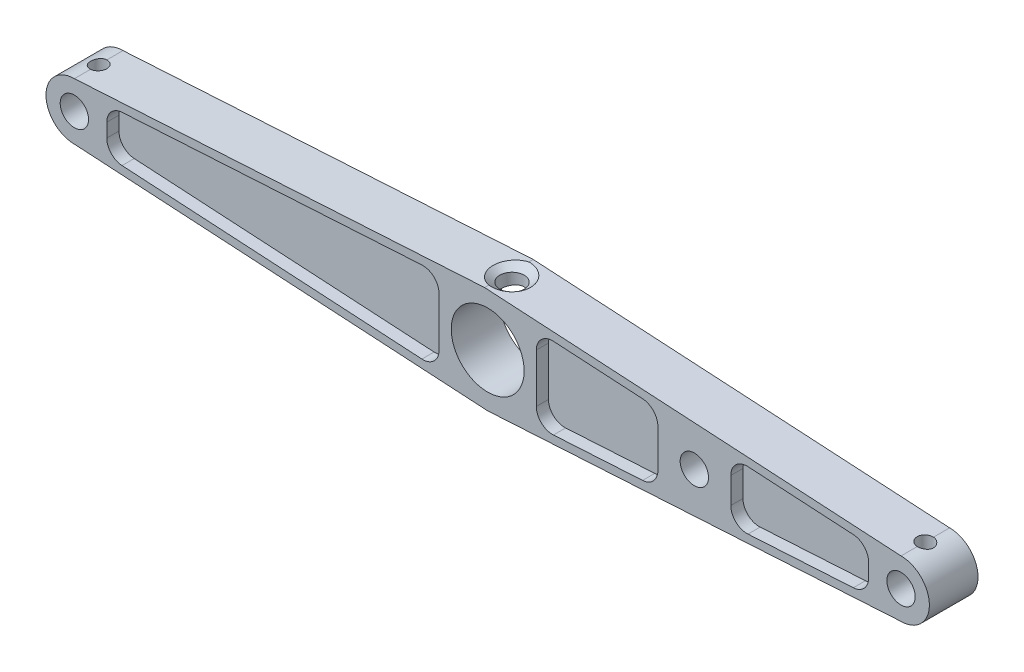
from build123d import *

# Parameters (mm, degrees)
SKETCH1_R           = 4.5
SKETCH1_R_2         = 1.75
BOSS_EXTRUDE1_DEPTH = 6
CUT_EXTRUDE1_DEPTH  = 1.5
LPATTERN1_COUNT     = 2
LPATTERN1_PITCH     = 4.5
CUT_EXTRUDE2_DEPTH  = 1.5
LPATTERN2_COUNT     = 2
LPATTERN2_PITCH     = 4.5
CUT_EXTRUDE3_DEPTH  = 1.5
LPATTERN3_COUNT     = 2
LPATTERN3_PITCH     = 4.5
SKETCH5_R           = 1.75
CUT_EXTRUDE4_DEPTH  = 11.5
SKETCH8_R           = 1
CUT_EXTRUDE5_DEPTH  = 7


with BuildPart() as part:
    # Sketch1 → Boss-Extrude1 (new body)
    with BuildSketch(Plane.XY):
        with BuildLine():
            Line((0, -6.5), (51, -3.5))
            ThreePointArc((51, -3.5), (54.5, 0), (51, 3.5))
            Line((51, 3.5), (-0.383128511, 6.488698833))
            Line((-0.383128511, 6.488698833), (-51, 3.5))
            ThreePointArc((-51, 3.5), (-54.5, 0), (-51, -3.5))
            Line((-51, -3.5), (0, -6.5))
        make_face()
        Circle(SKETCH1_R, mode=Mode.SUBTRACT)
        with Locations((-51, 0)):
            Circle(SKETCH1_R_2, mode=Mode.SUBTRACT)
        with Locations((51, 0)):
            Circle(SKETCH1_R_2, mode=Mode.SUBTRACT)
    extrude(amount=BOSS_EXTRUDE1_DEPTH)

    # Sketch2 → Cut-Extrude1 (cut)
    with BuildSketch(Plane.XY.offset(6)):
        with BuildLine():
            Line((-8.117885696, 5.030254505), (-45.117885696, 2.845570751))
            ThreePointArc((-45.117885696, 2.845570751), (-46.455295742, 2.220949744), (-47, 0.849048033))
            Line((-47, 0.849048033), (-47, -0.847755347))
            ThreePointArc((-47, -0.847755347), (-46.455143994, -2.219818012), (-45.117444044, -2.844304094))
            Line((-45.117444044, -2.844304094), (-8.117444044, -5.020774682))
            ThreePointArc((-8.117444044, -5.020774682), (-6.627937335, -4.47936993), (-6, -3.024225935))
            Line((-6, -3.024225935), (-6, 3.033731787))
            ThreePointArc((-6, 3.033731787), (-6.628098289, 4.489027529), (-8.117885696, 5.030254505))
        make_face()
    cut_extrude1 = extrude(amount=-CUT_EXTRUDE1_DEPTH, mode=Mode.SUBTRACT)

    # LPattern1: Cut-Extrude1 ×2
    with Locations(*[(0, 0, -i * LPATTERN1_PITCH) for i in range(1, LPATTERN1_COUNT)]):
        add(cut_extrude1, mode=Mode.SUBTRACT)

    # Sketch3 → Cut-Extrude2 (cut)
    with BuildSketch(Plane.XY.offset(6)):
        with BuildLine():
            Line((8.116133684, 4.992649231), (19.116133684, 4.352834411))
            ThreePointArc((19.116133684, 4.352834411), (20.454693673, 3.728749112), (21, 2.356209016))
            Line((21, 2.356209016), (21, -2.377167112))
            ThreePointArc((21, -2.377167112), (20.455143994, -3.749229777), (19.117444044, -4.373715858))
            Line((19.117444044, -4.373715858), (8.117444044, -5.020774682))
            ThreePointArc((8.117444044, -5.020774682), (6.627937335, -4.47936993), (6, -3.024225935))
            Line((6, -3.024225935), (6, 2.996023836))
            ThreePointArc((6, 2.996023836), (6.627459904, 4.45071751), (8.116133684, 4.992649231))
        make_face()
    cut_extrude2 = extrude(amount=-CUT_EXTRUDE2_DEPTH, mode=Mode.SUBTRACT)

    # LPattern2: Cut-Extrude2 ×2
    with Locations(*[(0, 0, -i * LPATTERN2_PITCH) for i in range(1, LPATTERN2_COUNT)]):
        add(cut_extrude2, mode=Mode.SUBTRACT)

    # Sketch4 → Cut-Extrude3 (cut)
    with BuildSketch(Plane.XY.offset(6)):
        with BuildLine():
            Line((47, 0.843919439), (47, -0.847755347))
            ThreePointArc((47, -0.847755347), (46.455143994, -2.219818012), (45.117444044, -2.844304094))
            Line((45.117444044, -2.844304094), (32.117444044, -3.609009976))
            ThreePointArc((32.117444044, -3.609009976), (30.627937335, -3.067605224), (30, -1.61246123))
            Line((30, -1.61246123), (30, 1.600064227))
            ThreePointArc((30, 1.600064227), (30.627459904, 3.054757901), (32.116133684, 3.596689622))
            Line((32.116133684, 3.596689622), (45.116133684, 2.840544834))
            ThreePointArc((45.116133684, 2.840544834), (46.454693673, 2.216459536), (47, 0.843919439))
        make_face()
    cut_extrude3 = extrude(amount=-CUT_EXTRUDE3_DEPTH, mode=Mode.SUBTRACT)

    # LPattern3: Cut-Extrude3 ×2
    with Locations(*[(0, 0, -i * LPATTERN3_PITCH) for i in range(1, LPATTERN3_COUNT)]):
        add(cut_extrude3, mode=Mode.SUBTRACT)

    # Sketch5 → Cut-Extrude4 (cut)
    with BuildSketch(Plane.XY.offset(6)):
        with Locations((25.5, 0)):
            Circle(SKETCH5_R)
    extrude(amount=-CUT_EXTRUDE4_DEPTH, mode=Mode.SUBTRACT)

    # Sketch7 → Cut-Revolve1 (revolve, cut)
    with BuildSketch(Plane(origin=(0, 0, 0), x_dir=(0, 0, -1), z_dir=(1, 0, 0)), mode=Mode.PRIVATE) as cut_revolve1_sk:
        Polygon((-3, 6.488698833), (-5.5, 6.488698833), (-4.5, 5.75735408), (-4.5, 2.301697652), (-3, 2.301697652), (-3, 5.75735408), align=None)
    revolve(cut_revolve1_sk.sketch.rotate(Axis((0, 2.301697652, 3), (0, 1, 0)), 351.184602487), axis=Axis((0, 2.301697652, 3), (0, 1, 0)), mode=Mode.SUBTRACT)

    # Sketch8 → Cut-Extrude5 (cut)
    with BuildSketch(Plane(origin=(0, 6.488698833, 0), x_dir=(1, 0, 0), z_dir=(0, 1, 0))):
        with Locations(Location((-51, -3, 0), (0, 0, 270))):
            Circle(SKETCH8_R)
        with Locations(Location((51, -3, 0), (0, 0, 270))):
            Circle(SKETCH8_R)
    extrude(amount=-CUT_EXTRUDE5_DEPTH, mode=Mode.SUBTRACT)


solid = part.part
